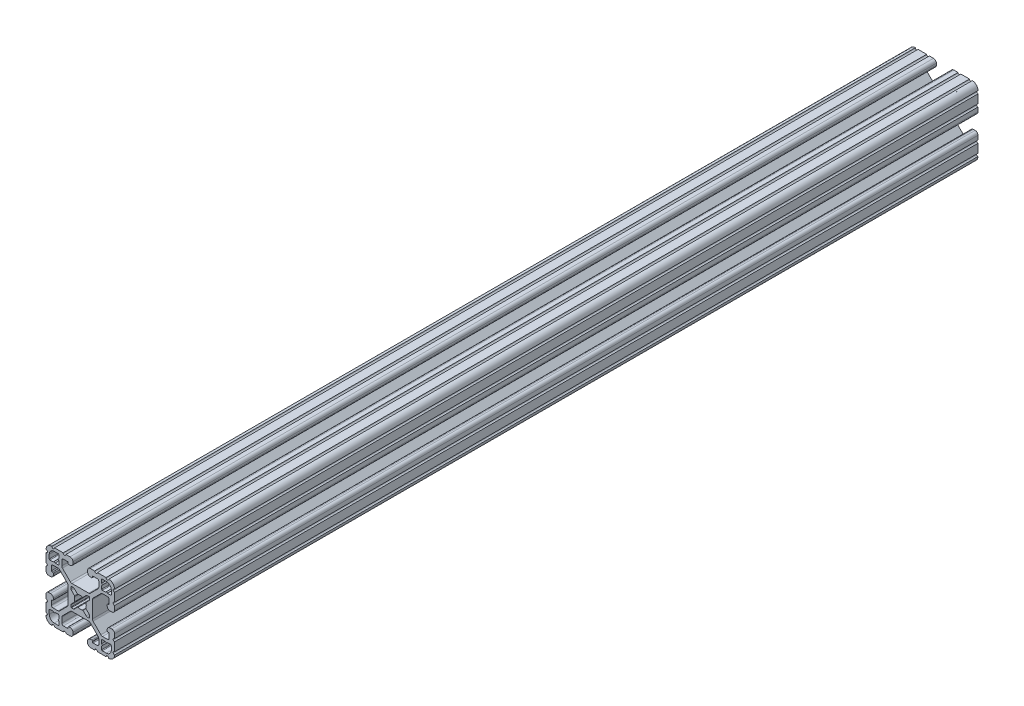
from build123d import *

# Parameters (mm, degrees)
BOSS_EXTRUDE1_DEPTH = 480


with BuildPart() as part:
    # Sketch1 → Boss-Extrude1 (new body)
    with BuildSketch(Plane(origin=(0, 0, -304.8), x_dir=(-1, 0, 0), z_dir=(0, 0, -1))):
        with BuildLine():
            Line((-6.73100886, -15.366075826), (-6.73099868, -15.696937689))
            ThreePointArc((-6.73099868, -15.696937689), (-6.842585243, -15.966583596), (-7.112226419, -16.07818159))
            Line((-7.112226419, -16.07818159), (-9.396837733, -16.078206437))
            ThreePointArc((-9.396837733, -16.078206437), (-10.026619161, -15.817838361), (-10.287014485, -15.188068198))
            Line((-10.287014485, -15.188068198), (-10.287102084, -12.380007911))
            ThreePointArc((-10.287102084, -12.380007911), (-10.190172691, -11.893341792), (-9.914152226, -11.480968269))
            Line((-9.914152226, -11.480968269), (-5.538418688, -7.114725458))
            ThreePointArc((-5.538418688, -7.114725458), (-5.126739523, -6.840134831), (-4.641368546, -6.743725482))
            Line((-4.641368546, -6.743725482), (4.66887658, -6.743725482))
            ThreePointArc((4.66887658, -6.743725482), (5.154247557, -6.840134831), (5.565926722, -7.114725458))
            Line((5.565926722, -7.114725458), (9.914153246, -11.453520916))
            ThreePointArc((9.914153246, -11.453520916), (10.190173777, -11.865894597), (10.287103104, -12.352560901))
            Line((10.287103104, -12.352560901), (10.287013883, -15.1880682))
            ThreePointArc((10.287013883, -15.1880682), (10.026619125, -15.817838632), (9.396837895, -16.078207274))
            Line((9.396837895, -16.078207274), (7.11222652, -16.07818159))
            ThreePointArc((7.11222652, -16.07818159), (6.842585364, -15.966583624), (6.730998773, -15.696937762))
            Line((6.730998773, -15.696937762), (6.731009023, -15.366075897))
            ThreePointArc((6.731009023, -15.366075897), (6.619420969, -15.0964285), (6.349777068, -14.984832))
            Line((6.349777068, -14.984832), (5.653061402, -14.984832))
            ThreePointArc((5.653061402, -14.984832), (4.539002225, -15.446080193), (4.077754017, -16.560139363))
            Line((4.077754017, -16.560139363), (4.077754017, -17.474692623))
            ThreePointArc((4.077754017, -17.474692623), (4.53900218, -18.588751833), (5.653061359, -19.050000071))
            Line((5.653061359, -19.050000071), (7.9756, -19.050000071))
            ThreePointArc((7.9756, -19.050000071), (8.737600071, -18.288), (9.499600141, -19.050000071))
            Line((9.499600141, -19.050000071), (14.3256, -19.050000071))
            ThreePointArc((14.3256, -19.050000071), (15.087549199, -18.288000072), (15.849599993, -19.049898469))
            ThreePointArc((15.849599993, -19.049898469), (18.129769245, -18.110316749), (19.049559142, -15.822092073))
            ThreePointArc((19.049559142, -15.822092073), (18.287999891, -15.059871752), (19.049999918, -14.298092081))
            Line((19.049999918, -14.298092081), (19.049999918, -9.499600082))
            ThreePointArc((19.049999918, -9.499600082), (18.287999848, -8.737600011), (19.049999918, -7.97559994))
            Line((19.049999918, -7.97559994), (19.049999918, -5.653061444))
            ThreePointArc((19.049999918, -5.653061444), (18.588751741, -4.53900224), (17.474692556, -4.077754017))
            Line((17.474692556, -4.077754017), (16.560139291, -4.077754017))
            ThreePointArc((16.560139291, -4.077754017), (15.446080144, -4.539002192), (14.984831919, -5.653061318))
            Line((14.984831919, -5.653061318), (14.984831919, -6.349777007))
            ThreePointArc((14.984831919, -6.349777007), (15.096428376, -6.619420915), (15.366075744, -6.731009012))
            Line((15.366075744, -6.731009012), (15.696937607, -6.730998762))
            ThreePointArc((15.696937607, -6.730998762), (15.966583514, -6.842585324), (16.078181509, -7.1122265))
            Line((16.078181509, -7.1122265), (16.078206356, -9.396837815))
            ThreePointArc((16.078206356, -9.396837815), (15.817838279, -10.026619243), (15.188068116, -10.287014567))
            Line((15.188068116, -10.287014567), (12.380007829, -10.287102166))
            ThreePointArc((12.380007829, -10.287102166), (11.89334171, -10.190172773), (11.480968187, -9.914152308))
            Line((11.480968187, -9.914152308), (7.114725376, -5.53841877))
            ThreePointArc((7.114725376, -5.53841877), (6.840134749, -5.126739605), (6.7437254, -4.641368628))
            Line((6.7437254, -4.641368628), (6.7437254, 4.668876499))
            ThreePointArc((6.7437254, 4.668876499), (6.840134749, 5.154247475), (7.114725376, 5.565926641))
            Line((7.114725376, 5.565926641), (11.453520834, 9.914153164))
            ThreePointArc((11.453520834, 9.914153164), (11.865894515, 10.190173695), (12.352560819, 10.287103022))
            Line((12.352560819, 10.287103022), (15.188068118, 10.287013802))
            ThreePointArc((15.188068118, 10.287013802), (15.817838504, 10.026619018), (16.078207121, 9.396837814))
            Line((16.078207121, 9.396837814), (16.078181438, 7.112226438))
            ThreePointArc((16.078181438, 7.112226438), (15.966583497, 6.842585307), (15.69693768, 6.730998691))
            Line((15.69693768, 6.730998691), (15.366075815, 6.731008942))
            ThreePointArc((15.366075815, 6.731008942), (15.096428419, 6.619420887), (14.984831919, 6.349776986))
            Line((14.984831919, 6.349776986), (14.984831919, 5.653061321))
            ThreePointArc((14.984831919, 5.653061321), (15.446080086, 4.539002168), (16.560139211, 4.077753935))
            Line((16.560139211, 4.077753935), (17.474692471, 4.077753935))
            ThreePointArc((17.474692471, 4.077753935), (18.588751681, 4.539002098), (19.049999918, 5.653061278))
            Line((19.049999918, 5.653061278), (19.049999918, 7.975599918))
            ThreePointArc((19.049999918, 7.975599918), (18.287999848, 8.737599989), (19.049999918, 9.49960006))
            Line((19.049999918, 9.49960006), (19.049999918, 14.325599907))
            ThreePointArc((19.049999918, 14.325599907), (18.287999909, 15.087549194), (19.049898469, 15.849599923))
            ThreePointArc((19.049898469, 15.849599923), (18.110316749, 18.129769174), (15.822092073, 19.049559071))
            ThreePointArc((15.822092073, 19.049559071), (15.059871665, 18.287999961), (14.298092059, 19.05))
            Line((14.298092059, 19.05), (9.499600071, 19.05))
            ThreePointArc((9.499600071, 19.05), (8.7376, 18.287999929), (7.975599929, 19.05))
            Line((7.975599929, 19.05), (5.653061433, 19.05))
            ThreePointArc((5.653061433, 19.05), (4.539002182, 18.588751765), (4.077754017, 17.474692486))
            Line((4.077754017, 17.474692486), (4.077754017, 16.560139221))
            ThreePointArc((4.077754017, 16.560139221), (4.539002167, 15.446080028), (5.653061318, 14.984831777))
            Line((5.653061318, 14.984831777), (6.349777007, 14.984831777))
            ThreePointArc((6.349777007, 14.984831777), (6.619420905, 15.096428224), (6.731008942, 15.366075603))
            Line((6.731008942, 15.366075603), (6.730998762, 15.696937466))
            ThreePointArc((6.730998762, 15.696937466), (6.842585324, 15.966583373), (7.1122265, 16.078181367))
            Line((7.1122265, 16.078181367), (9.396837815, 16.078206214))
            ThreePointArc((9.396837815, 16.078206214), (10.026619218, 15.817838163), (10.287014567, 15.188068045))
            Line((10.287014567, 15.188068045), (10.287102166, 12.380007759))
            ThreePointArc((10.287102166, 12.380007759), (10.190172773, 11.893341639), (9.914152308, 11.480968117))
            Line((9.914152308, 11.480968117), (5.53841877, 7.114725305))
            ThreePointArc((5.53841877, 7.114725305), (5.126739605, 6.840134679), (4.641368628, 6.743725329))
            Line((4.641368628, 6.743725329), (-4.668876499, 6.743725329))
            ThreePointArc((-4.668876499, 6.743725329), (-5.154247475, 6.840134679), (-5.565926641, 7.114725305))
            Line((-5.565926641, 7.114725305), (-9.914153164, 11.453520764))
            ThreePointArc((-9.914153164, 11.453520764), (-10.190173695, 11.865894444), (-10.287103022, 12.352560749))
            Line((-10.287103022, 12.352560749), (-10.287013801, 15.188068048))
            ThreePointArc((-10.287013801, 15.188068048), (-10.026619018, 15.817838433), (-9.396837814, 16.07820705))
            Line((-9.396837814, 16.07820705), (-7.112226438, 16.078181367))
            ThreePointArc((-7.112226438, 16.078181367), (-6.842585282, 15.966583401), (-6.730998691, 15.696937539))
            Line((-6.730998691, 15.696937539), (-6.731008942, 15.366075673))
            ThreePointArc((-6.731008942, 15.366075673), (-6.619420887, 15.096428277), (-6.349776986, 14.984831777))
            Line((-6.349776986, 14.984831777), (-5.653061321, 14.984831777))
            ThreePointArc((-5.653061321, 14.984831777), (-4.539002143, 15.446079969), (-4.077753935, 16.56013914))
            Line((-4.077753935, 16.56013914), (-4.077753935, 17.4746924))
            ThreePointArc((-4.077753935, 17.4746924), (-4.539002048, 18.588751713), (-5.653061289, 19.05))
            Line((-5.653061289, 19.05), (-7.975599929, 19.05))
            ThreePointArc((-7.975599929, 19.05), (-8.7376, 18.287999929), (-9.499600071, 19.05))
            Line((-9.499600071, 19.05), (-14.325599929, 19.05))
            ThreePointArc((-14.325599929, 19.05), (-15.087549128, 18.288000002), (-15.849599922, 19.049898398))
            ThreePointArc((-15.849599922, 19.049898398), (-18.129769174, 18.110316678), (-19.049559071, 15.822092002))
            ThreePointArc((-19.049559071, 15.822092002), (-18.287999961, 15.059871594), (-19.05, 14.298091988))
            Line((-19.05, 14.298091988), (-19.05, 9.4996))
            ThreePointArc((-19.05, 9.4996), (-18.287999929, 8.737599929), (-19.05, 7.975599859))
            Line((-19.05, 7.975599859), (-19.05, 5.653061362))
            ThreePointArc((-19.05, 5.653061362), (-18.588751823, 4.539002158), (-17.474692638, 4.077753935))
            Line((-17.474692638, 4.077753935), (-16.560139373, 4.077753935))
            ThreePointArc((-16.560139373, 4.077753935), (-15.44608018, 4.539002085), (-14.98483193, 5.653061237))
            Line((-14.98483193, 5.653061237), (-14.98483193, 6.349776926))
            ThreePointArc((-14.98483193, 6.349776926), (-15.096428387, 6.619420834), (-15.366075755, 6.731008931))
            Line((-15.366075755, 6.731008931), (-15.696937618, 6.73099868))
            ThreePointArc((-15.696937618, 6.73099868), (-15.966583525, 6.842585243), (-16.07818152, 7.112226419))
            Line((-16.07818152, 7.112226419), (-16.078206367, 9.396837733))
            ThreePointArc((-16.078206367, 9.396837733), (-15.81783829, 10.026619162), (-15.188068127, 10.287014485))
            Line((-15.188068127, 10.287014485), (-12.38000784, 10.287102084))
            ThreePointArc((-12.38000784, 10.287102084), (-11.893341721, 10.190172691), (-11.480968198, 9.914152226))
            Line((-11.480968198, 9.914152226), (-7.114725458, 5.538418759))
            ThreePointArc((-7.114725458, 5.538418759), (-6.840134831, 5.126739594), (-6.743725482, 4.641368617))
            Line((-6.743725482, 4.641368617), (-6.743725482, -4.66887658))
            ThreePointArc((-6.743725482, -4.66887658), (-6.840134831, -5.154247557), (-7.114725458, -5.565926722))
            Line((-7.114725458, -5.565926722), (-11.453520916, -9.914153246))
            ThreePointArc((-11.453520916, -9.914153246), (-11.865894597, -10.190173777), (-12.352560901, -10.287103104))
            Line((-12.352560901, -10.287103104), (-15.1880682, -10.287013883))
            ThreePointArc((-15.1880682, -10.287013883), (-15.817838586, -10.0266191), (-16.078207203, -9.396837895))
            Line((-16.078207203, -9.396837895), (-16.07818152, -7.11222652))
            ThreePointArc((-16.07818152, -7.11222652), (-15.966583554, -6.842585364), (-15.696937691, -6.730998773))
            Line((-15.696937691, -6.730998773), (-15.366075826, -6.731009023))
            ThreePointArc((-15.366075826, -6.731009023), (-15.09642843, -6.619420969), (-14.98483193, -6.349777068))
            Line((-14.98483193, -6.349777068), (-14.98483193, -5.653061402))
            ThreePointArc((-14.98483193, -5.653061402), (-15.446080122, -4.539002225), (-16.560139293, -4.077754017))
            Line((-16.560139293, -4.077754017), (-17.474692553, -4.077754017))
            ThreePointArc((-17.474692553, -4.077754017), (-18.588751763, -4.53900218), (-19.05, -5.653061359))
            Line((-19.05, -5.653061359), (-19.05, -7.9756))
            ThreePointArc((-19.05, -7.9756), (-18.287999929, -8.737600071), (-19.05, -9.499600141))
            Line((-19.05, -9.499600141), (-19.05, -14.3256))
            ThreePointArc((-19.05, -14.3256), (-18.288000002, -15.087549199), (-19.049898398, -15.849599993))
            ThreePointArc((-19.049898398, -15.849599993), (-18.110316678, -18.129769245), (-15.822092002, -19.049559142))
            ThreePointArc((-15.822092002, -19.049559142), (-15.059871594, -18.288000032), (-14.298091988, -19.050000071))
            Line((-14.298091988, -19.050000071), (-9.4996, -19.050000071))
            ThreePointArc((-9.4996, -19.050000071), (-8.737599929, -18.288), (-7.975599859, -19.050000071))
            Line((-7.975599859, -19.050000071), (-5.653061362, -19.050000071))
            ThreePointArc((-5.653061362, -19.050000071), (-4.539002158, -18.588751894), (-4.077753935, -17.474692709))
            Line((-4.077753935, -17.474692709), (-4.077753935, -16.560139444))
            ThreePointArc((-4.077753935, -16.560139444), (-4.539002085, -15.446080251), (-5.653061237, -14.984832))
            Line((-5.653061237, -14.984832), (-6.349776926, -14.984832))
            ThreePointArc((-6.349776926, -14.984832), (-6.619420823, -15.096428448), (-6.73100886, -15.366075826))
        make_face()
        with BuildLine():
            Line((-12.24788, 11.8669054), (-14.019430433, 11.8669054))
            ThreePointArc((-14.019430433, 11.8669054), (-14.020402436, 11.867098741), (-14.021226465, 11.867649329))
            Line((-14.021226465, 11.867649329), (-14.557487025, 12.403898231))
            ThreePointArc((-14.557487025, 12.403898231), (-14.559283084, 12.404642161), (-14.561079127, 12.403898192))
            Line((-14.561079127, 12.403898192), (-15.097316294, 11.867649368))
            ThreePointArc((-15.097316294, 11.867649368), (-15.098140336, 11.867098751), (-15.099112365, 11.8669054))
            Line((-15.099112365, 11.8669054), (-16.87068, 11.8669054))
            ThreePointArc((-16.87068, 11.8669054), (-17.140087684, 11.978497716), (-17.25168, 12.2479054))
            Line((-17.25168, 12.2479054), (-17.25168, 14.4577054))
            ThreePointArc((-17.25168, 14.4577054), (-16.433336347, 16.433361747), (-14.45768, 17.2517054))
            Line((-14.45768, 17.2517054), (-12.24788, 17.2517054))
            ThreePointArc((-12.24788, 17.2517054), (-11.978472316, 17.140113084), (-11.86688, 16.8707054))
            Line((-11.86688, 16.8707054), (-11.86688, 15.099137765))
            ThreePointArc((-11.86688, 15.099137765), (-11.867073351, 15.098165736), (-11.867623968, 15.097341694))
            Line((-11.867623968, 15.097341694), (-12.403872792, 14.561104527))
            ThreePointArc((-12.403872792, 14.561104527), (-12.404616761, 14.559308484), (-12.403872831, 14.557512425))
            Line((-12.403872831, 14.557512425), (-11.867623929, 14.021251865))
            ThreePointArc((-11.867623929, 14.021251865), (-11.867073341, 14.020427836), (-11.86688, 14.019455833))
            Line((-11.86688, 14.019455833), (-11.86688, 12.2479054))
            ThreePointArc((-11.86688, 12.2479054), (-11.978472316, 11.978497716), (-12.24788, 11.8669054))
        make_face(mode=Mode.SUBTRACT)
        with BuildLine():
            Line((-11.8669054, -12.24788), (-11.8669054, -14.019430433))
            ThreePointArc((-11.8669054, -14.019430433), (-11.867098741, -14.020402436), (-11.867649329, -14.021226465))
            Line((-11.867649329, -14.021226465), (-12.403898231, -14.557487025))
            ThreePointArc((-12.403898231, -14.557487025), (-12.404642161, -14.559283084), (-12.403898192, -14.561079127))
            Line((-12.403898192, -14.561079127), (-11.867649368, -15.097316294))
            ThreePointArc((-11.867649368, -15.097316294), (-11.867098751, -15.098140336), (-11.8669054, -15.099112365))
            Line((-11.8669054, -15.099112365), (-11.8669054, -16.87068))
            ThreePointArc((-11.8669054, -16.87068), (-11.978497716, -17.140087684), (-12.2479054, -17.25168))
            Line((-12.2479054, -17.25168), (-14.4577054, -17.25168))
            ThreePointArc((-14.4577054, -17.25168), (-16.433361747, -16.433336347), (-17.2517054, -14.45768))
            Line((-17.2517054, -14.45768), (-17.2517054, -12.24788))
            ThreePointArc((-17.2517054, -12.24788), (-17.140113084, -11.978472316), (-16.8707054, -11.86688))
            Line((-16.8707054, -11.86688), (-15.099137765, -11.86688))
            ThreePointArc((-15.099137765, -11.86688), (-15.098165736, -11.867073351), (-15.097341694, -11.867623968))
            Line((-15.097341694, -11.867623968), (-14.561104527, -12.403872792))
            ThreePointArc((-14.561104527, -12.403872792), (-14.559308484, -12.404616761), (-14.557512425, -12.403872831))
            Line((-14.557512425, -12.403872831), (-14.021251865, -11.867623929))
            ThreePointArc((-14.021251865, -11.867623929), (-14.020427836, -11.867073341), (-14.019455833, -11.86688))
            Line((-14.019455833, -11.86688), (-12.2479054, -11.86688))
            ThreePointArc((-12.2479054, -11.86688), (-11.978497716, -11.978472316), (-11.8669054, -12.24788))
        make_face(mode=Mode.SUBTRACT)
        with BuildLine():
            Line((12.24788, -11.8669054), (14.019430433, -11.8669054))
            ThreePointArc((14.019430433, -11.8669054), (14.020402437, -11.867098741), (14.021226465, -11.867649329))
            Line((14.021226465, -11.867649329), (14.557487025, -12.403898231))
            ThreePointArc((14.557487025, -12.403898231), (14.559283084, -12.40464216), (14.561079127, -12.403898192))
            Line((14.561079127, -12.403898192), (15.097316294, -11.867649368))
            ThreePointArc((15.097316294, -11.867649368), (15.098140336, -11.867098751), (15.099112365, -11.8669054))
            Line((15.099112365, -11.8669054), (16.87068, -11.8669054))
            ThreePointArc((16.87068, -11.8669054), (17.140087684, -11.978497716), (17.25168, -12.2479054))
            Line((17.25168, -12.2479054), (17.25168, -14.4577054))
            ThreePointArc((17.25168, -14.4577054), (16.433336347, -16.433361746), (14.45768, -17.2517054))
            Line((14.45768, -17.2517054), (12.24788, -17.2517054))
            ThreePointArc((12.24788, -17.2517054), (11.978472316, -17.140113083), (11.86688, -16.8707054))
            Line((11.86688, -16.8707054), (11.86688, -15.099137764))
            ThreePointArc((11.86688, -15.099137764), (11.867073351, -15.098165736), (11.867623968, -15.097341694))
            Line((11.867623968, -15.097341694), (12.403872792, -14.561104527))
            ThreePointArc((12.403872792, -14.561104527), (12.404616761, -14.559308484), (12.403872831, -14.557512425))
            Line((12.403872831, -14.557512425), (11.867623929, -14.021251865))
            ThreePointArc((11.867623929, -14.021251865), (11.867073341, -14.020427836), (11.86688, -14.019455833))
            Line((11.86688, -14.019455833), (11.86688, -12.2479054))
            ThreePointArc((11.86688, -12.2479054), (11.978472316, -11.978497716), (12.24788, -11.8669054))
        make_face(mode=Mode.SUBTRACT)
        with BuildLine():
            Line((11.8669054, 12.24788), (11.8669054, 14.019430433))
            ThreePointArc((11.8669054, 14.019430433), (11.867098741, 14.020402437), (11.867649329, 14.021226465))
            Line((11.867649329, 14.021226465), (12.403898231, 14.557487025))
            ThreePointArc((12.403898231, 14.557487025), (12.40464216, 14.559283084), (12.403898192, 14.561079127))
            Line((12.403898192, 14.561079127), (11.867649368, 15.097316294))
            ThreePointArc((11.867649368, 15.097316294), (11.867098751, 15.098140336), (11.8669054, 15.099112365))
            Line((11.8669054, 15.099112365), (11.8669054, 16.87068))
            ThreePointArc((11.8669054, 16.87068), (11.978497716, 17.140087684), (12.2479054, 17.25168))
            Line((12.2479054, 17.25168), (14.4577054, 17.25168))
            ThreePointArc((14.4577054, 17.25168), (16.433361746, 16.433336347), (17.2517054, 14.45768))
            Line((17.2517054, 14.45768), (17.2517054, 12.24788))
            ThreePointArc((17.2517054, 12.24788), (17.140113083, 11.978472316), (16.8707054, 11.86688))
            Line((16.8707054, 11.86688), (15.099137765, 11.86688))
            ThreePointArc((15.099137765, 11.86688), (15.098165736, 11.867073351), (15.097341694, 11.867623968))
            Line((15.097341694, 11.867623968), (14.561104527, 12.403872792))
            ThreePointArc((14.561104527, 12.403872792), (14.559308484, 12.404616761), (14.557512425, 12.403872831))
            Line((14.557512425, 12.403872831), (14.021251865, 11.867623929))
            ThreePointArc((14.021251865, 11.867623929), (14.020427836, 11.867073341), (14.019455833, 11.86688))
            Line((14.019455833, 11.86688), (12.2479054, 11.86688))
            ThreePointArc((12.2479054, 11.86688), (11.978497716, 11.978472316), (11.8669054, 12.24788))
        make_face(mode=Mode.SUBTRACT)
        with BuildLine():
            Line((1.582347442, 3.198793544), (3.292097227, 4.908543328))
            ThreePointArc((3.292097227, 4.908543328), (3.580509584, 5.101254304), (3.920715155, 5.1689254))
            Line((3.920715155, 5.1689254), (4.9149254, 5.1689254))
            ThreePointArc((4.9149254, 5.1689254), (5.094530522, 5.094530522), (5.1689254, 4.9149254))
            Line((5.1689254, 4.9149254), (5.1689254, 3.920715155))
            ThreePointArc((5.1689254, 3.920715155), (5.101254304, 3.580509584), (4.908543328, 3.292097227))
            Line((4.908543328, 3.292097227), (3.198793543, 1.582347442))
            ThreePointArc((3.198793543, 1.582347442), (3.095711235, 1.393016011), (3.111879183, 1.178048687))
            ThreePointArc((3.111879183, 1.178048687), (3.3274, 0), (3.111879183, -1.178048687))
            ThreePointArc((3.111879183, -1.178048687), (3.095711235, -1.393016011), (3.198793543, -1.582347441))
            Line((3.198793543, -1.582347441), (4.908543328, -3.292097227))
            ThreePointArc((4.908543328, -3.292097227), (5.101254304, -3.580509584), (5.1689254, -3.920715155))
            Line((5.1689254, -3.920715155), (5.1689254, -4.9149254))
            ThreePointArc((5.1689254, -4.9149254), (5.094530522, -5.094530522), (4.9149254, -5.1689254))
            Line((4.9149254, -5.1689254), (3.920715155, -5.1689254))
            ThreePointArc((3.920715155, -5.1689254), (3.580509584, -5.101254304), (3.292097227, -4.908543328))
            Line((3.292097227, -4.908543328), (1.582347442, -3.198793543))
            ThreePointArc((1.582347442, -3.198793543), (1.393016011, -3.095711235), (1.178048687, -3.111879183))
            ThreePointArc((1.178048687, -3.111879183), (0, -3.3274), (-1.178048687, -3.111879183))
            ThreePointArc((-1.178048687, -3.111879183), (-1.393016011, -3.095711235), (-1.582347442, -3.198793543))
            Line((-1.582347442, -3.198793543), (-3.292097227, -4.908543328))
            ThreePointArc((-3.292097227, -4.908543328), (-3.580509584, -5.101254304), (-3.920715155, -5.1689254))
            Line((-3.920715155, -5.1689254), (-4.9149254, -5.1689254))
            ThreePointArc((-4.9149254, -5.1689254), (-5.094530522, -5.094530522), (-5.1689254, -4.9149254))
            Line((-5.1689254, -4.9149254), (-5.1689254, -3.920715155))
            ThreePointArc((-5.1689254, -3.920715155), (-5.101254304, -3.580509584), (-4.908543328, -3.292097227))
            Line((-4.908543328, -3.292097227), (-3.198793543, -1.582347442))
            ThreePointArc((-3.198793543, -1.582347442), (-3.095711236, -1.393016011), (-3.111879183, -1.178048687))
            ThreePointArc((-3.111879183, -1.178048687), (-3.3274, 0), (-3.111879183, 1.178048687))
            ThreePointArc((-3.111879183, 1.178048687), (-3.095711236, 1.393016011), (-3.198793544, 1.582347442))
            Line((-3.198793544, 1.582347442), (-4.908543328, 3.292097227))
            ThreePointArc((-4.908543328, 3.292097227), (-5.101254304, 3.580509584), (-5.1689254, 3.920715155))
            Line((-5.1689254, 3.920715155), (-5.1689254, 4.9149254))
            ThreePointArc((-5.1689254, 4.9149254), (-5.094530522, 5.094530522), (-4.9149254, 5.1689254))
            Line((-4.9149254, 5.1689254), (-3.920715155, 5.1689254))
            ThreePointArc((-3.920715155, 5.1689254), (-3.580509584, 5.101254304), (-3.292097227, 4.908543328))
            Line((-3.292097227, 4.908543328), (-1.582347442, 3.198793544))
            ThreePointArc((-1.582347442, 3.198793544), (-1.393016011, 3.095711236), (-1.178048687, 3.111879183))
            ThreePointArc((-1.178048687, 3.111879183), (0, 3.3274), (1.178048687, 3.111879183))
            ThreePointArc((1.178048687, 3.111879183), (1.393016011, 3.095711236), (1.582347442, 3.198793544))
        make_face(mode=Mode.SUBTRACT)
    extrude(amount=-BOSS_EXTRUDE1_DEPTH)


solid = part.part
